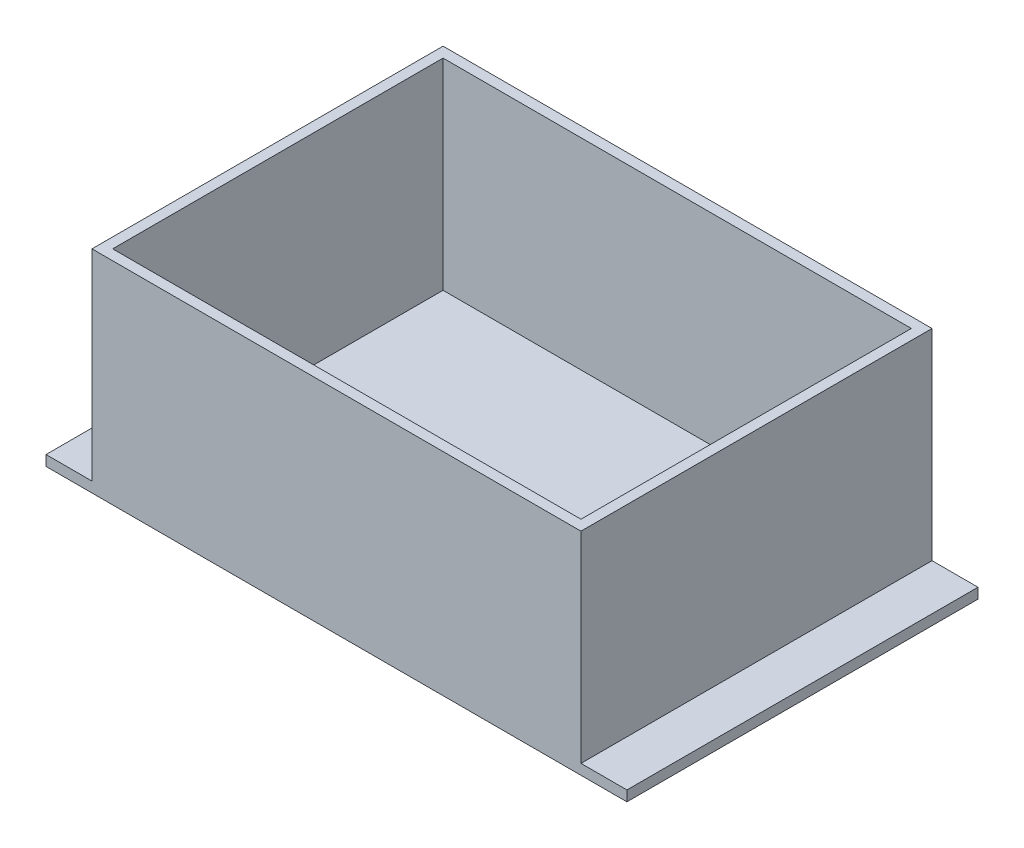
from build123d import *

# Parameters (mm, degrees)
SKICA1_W                = 85.1
SKICA1_H                = 61.1
SKICA1_W_2              = 81.5
SKICA1_H_2              = 57.5
P_IDAT_VYSUNUT_M1_DEPTH = 35
SKICA2_W                = 101.1
SKICA2_H                = 61.1
P_IDAT_VYSUNUT_M2_DEPTH = 1.8


with BuildPart() as part:
    # Skica1 → Přidat vysunutím1 (new body)
    with BuildSketch(Plane(origin=(0, 0, 0), x_dir=(1, 0, 0), z_dir=(0, 1, 0))):
        with Locations((40.75, 28.75)):
            Rectangle(SKICA1_W, SKICA1_H)
        with Locations((40.75, 28.75)):
            Rectangle(SKICA1_W_2, SKICA1_H_2, mode=Mode.SUBTRACT)
    extrude(amount=P_IDAT_VYSUNUT_M1_DEPTH)

    # Skica2 → Přidat vysunutím2 (add)
    with BuildSketch(Plane.XZ):
        with Locations((40.75, -28.75)):
            Rectangle(SKICA2_W, SKICA2_H)
    extrude(amount=P_IDAT_VYSUNUT_M2_DEPTH)


solid = part.part
